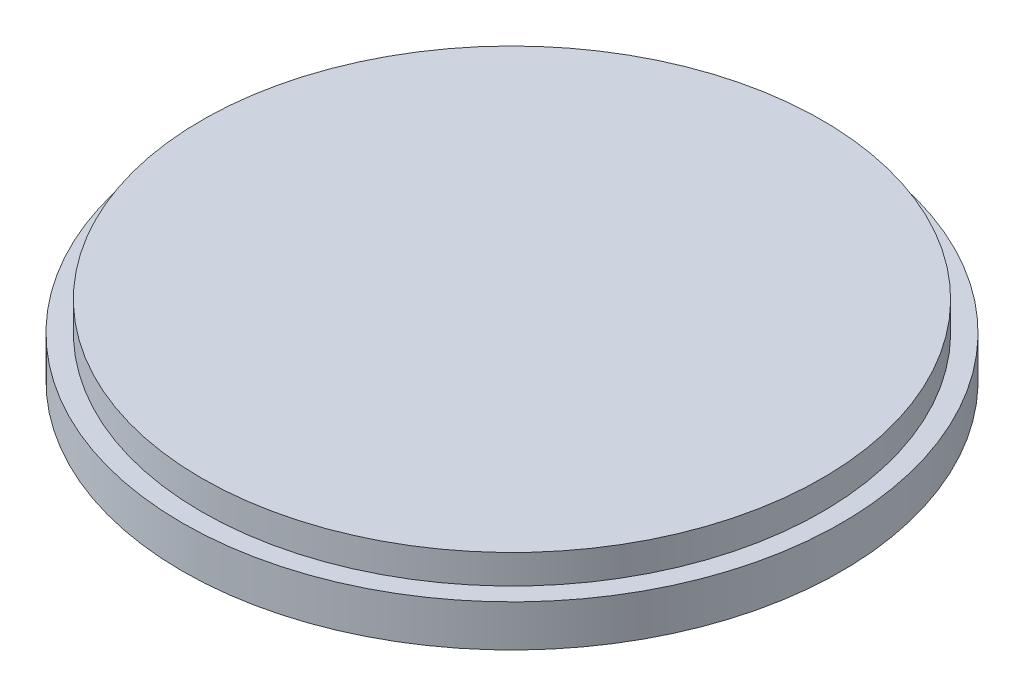
from build123d import *

# Parameters (mm, degrees)
SKETCH2_R                = 32
BOSS_EXTRUDE1_DEPTH      = 3
M3_CLEARANCE_HOLE1_D     = 3.4
M3_CLEARANCE_HOLE1_DEPTH = 4
M3_CLEARANCE_HOLE1_TIP   = 1.021463052


with BuildPart() as part:
    # Sketch1 → Revolve1 (revolve)
    with BuildSketch(Plane.XY, mode=Mode.PRIVATE) as revolve1_sk:
        Polygon((-26.5, -7.3), (-34, -4.3), (-34, 0), (0, 0), (0, -7.3), align=None)
    revolve(revolve1_sk.sketch.rotate(Axis((0, -7.3, 0), (0, 1, 0)), 270), axis=Axis((0, -7.3, 0), (0, 1, 0)))

    # Sketch2 → Boss-Extrude1 (add)
    with BuildSketch(Plane(origin=(0, 0, 0), x_dir=(1, 0, 0), z_dir=(0, 1, 0))):
        with Locations(Location((0, 0, 0), (0, 0, 270))):
            Circle(SKETCH2_R)
    extrude(amount=BOSS_EXTRUDE1_DEPTH)

    # M3 Clearance Hole1
    with Locations(Plane(origin=(0, -7.3, 0), x_dir=(-1, 0, 0), z_dir=(0, -1, 0))):
        with Locations((15.556349186, -15.556349186), (15.556349186, 15.556349186), (-15.556349186, 15.556349186), (-15.556349186, -15.556349186)):
            Hole(M3_CLEARANCE_HOLE1_D / 2, depth=M3_CLEARANCE_HOLE1_DEPTH)
            with Locations((0, 0, -(M3_CLEARANCE_HOLE1_DEPTH + M3_CLEARANCE_HOLE1_TIP / 2))):  # 118° drill point
                Cone(0, M3_CLEARANCE_HOLE1_D / 2, M3_CLEARANCE_HOLE1_TIP, mode=Mode.SUBTRACT)


solid = part.part
